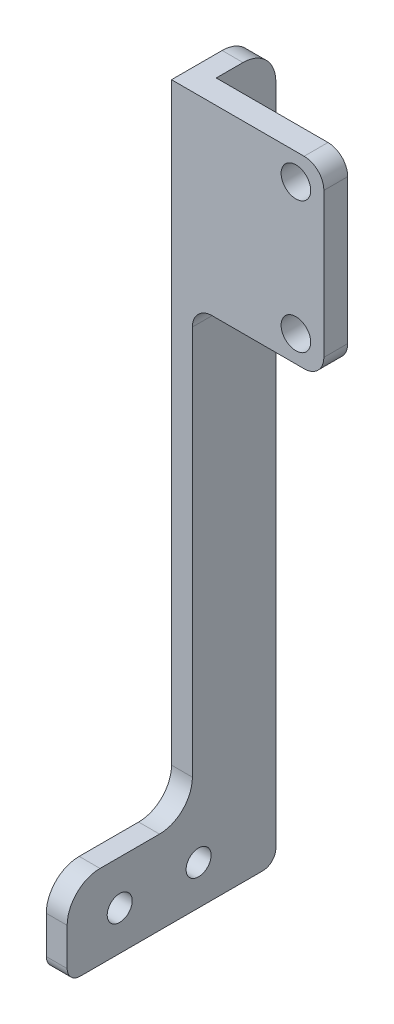
from build123d import *

# Parameters (mm, degrees)
BOSS_EXTRUDE1_DEPTH = 3.175
FILLET1_R           = 5
SKETCH3_W           = 3.629817958
SKETCH3_H           = 28
BOSS_EXTRUDE2_DEPTH = 20
SKETCH4_R           = 2.25
CUT_EXTRUDE1_DEPTH  = 3.629817958
FILLET2_R           = 3
FILLET3_R           = 2
SKETCH6_R           = 1.9
CUT_EXTRUDE2_DEPTH  = 3.175


with BuildPart() as part:
    # Sketch2 → Boss-Extrude1 (new body)
    with BuildSketch(Plane(origin=(0, 0, 0), x_dir=(0, 0, -1), z_dir=(1, 0, 0))):
        Polygon((-25.4, -95.305238918), (-6.35, -95.305238918), (-6.35, 0), (6.35, 0), (6.35, -108.005238918), (-25.4, -108.005238918), align=None)
    extrude(amount=-BOSS_EXTRUDE1_DEPTH)

    # Fillet1
    fillet1_edges = [part.edges().sort_by_distance(p)[0] for p in [
        (-1.5875, -95.305238918, 25.4),
        (-1.5875, -95.305238918, 6.35),
        (-1.5875, 0, -6.35),
    ]]
    fillet(fillet1_edges, radius=FILLET1_R)

    # Sketch3 → Boss-Extrude2 (add)
    with BuildSketch(Plane(origin=(0, 0, 0), x_dir=(0, 0, -1), z_dir=(1, 0, 0))):
        with Locations((-4.535091021, -14)):
            Rectangle(SKETCH3_W, SKETCH3_H)
    extrude(amount=BOSS_EXTRUDE2_DEPTH)

    # Sketch4 → Cut-Extrude1 (cut)
    with BuildSketch(Plane(origin=(0, 0, 2.720182042), x_dir=(-1, 0, 0), z_dir=(0, 0, -1))):
        with Locations((-15.75, -24)):
            Circle(SKETCH4_R)
        with Locations((-15.75, -4)):
            Circle(SKETCH4_R)
    extrude(amount=-CUT_EXTRUDE1_DEPTH, mode=Mode.SUBTRACT)

    # Fillet2
    fillet2_edges = [part.edges().sort_by_distance(p)[0] for p in [
        (0, -28, 4.535091021),
        (20, 0, 4.535091021),
        (20, -28, 4.535091021),
    ]]
    fillet(fillet2_edges, radius=FILLET2_R)

    # Fillet3
    fillet3_edges = [part.edges().sort_by_distance(p)[0] for p in [
        (-1.5875, -108.005238918, -6.35),
        (-1.5875, -108.005238918, 25.4),
    ]]
    fillet(fillet3_edges, radius=FILLET3_R)

    # Sketch6 → Cut-Extrude2 (cut)
    with BuildSketch(Plane(origin=(0, 0, 0), x_dir=(0, 0, -1), z_dir=(1, 0, 0))):
        with Locations((-5.405608289, -102.005238918)):
            Circle(SKETCH6_R)
        with Locations((-17.405608289, -102.005238918)):
            Circle(SKETCH6_R)
    extrude(amount=-CUT_EXTRUDE2_DEPTH, mode=Mode.SUBTRACT)


solid = part.part
